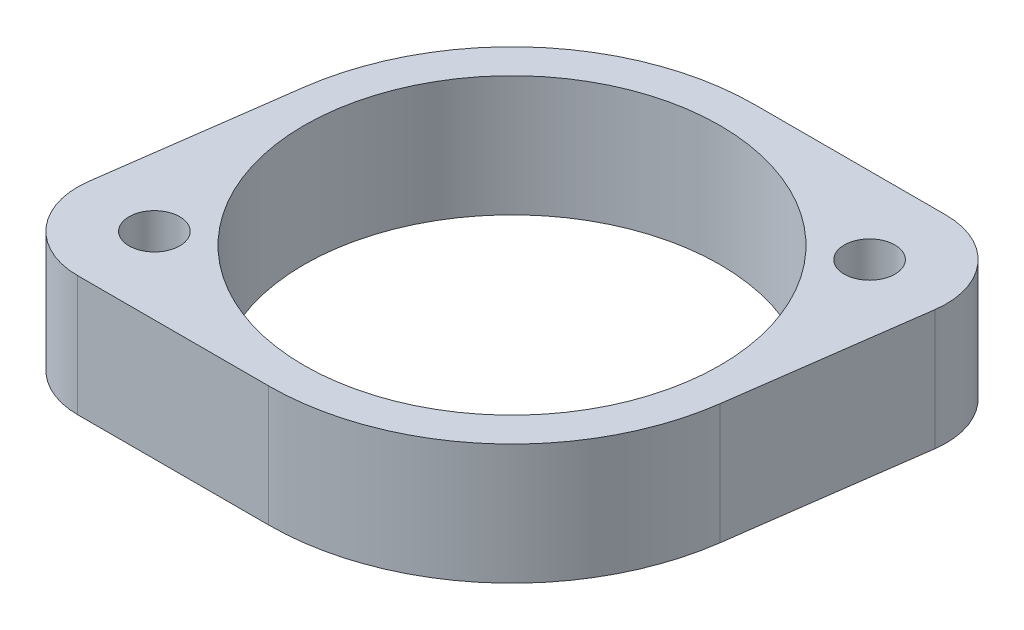
from build123d import *

# Parameters (mm, degrees)
SKETCH1_R           = 2.778125
SKETCH1_R_2         = 22.787762628
BOSS_EXTRUDE1_DEPTH = 13.208


with BuildPart() as part:
    # Sketch1 → Boss-Extrude1 (new body)
    with BuildSketch(Plane(origin=(0, 0, 0), x_dir=(1, 0, 0), z_dir=(0, 1, 0))):
        with BuildLine():
            Line((-29.275762083, -17.109232653), (-26.421007751, 3.635828571))
            ThreePointArc((-26.421007751, 3.635828571), (-17.526, 20.10294068), (0, 26.67))
            Line((0, 26.67), (20.940563209, 26.67))
            ThreePointArc((20.940563209, 26.67), (27.282562352, 23.785285714), (29.275762083, 17.109232653))
            Line((29.275762083, 17.109232653), (26.421007751, -3.635828571))
            ThreePointArc((26.421007751, -3.635828571), (17.526, -20.10294068), (0, -26.67))
            Line((0, -26.67), (-20.940563209, -26.67))
            ThreePointArc((-20.940563209, -26.67), (-27.282562352, -23.785285714), (-29.275762083, -17.109232653))
        make_face()
        with Locations(Location((20.940563209, 18.25625, 0), (0, 0, 90))):
            Circle(SKETCH1_R, mode=Mode.SUBTRACT)
        with Locations(Location((-20.940563209, -18.25625, 0), (0, 0, 90))):
            Circle(SKETCH1_R, mode=Mode.SUBTRACT)
        with Locations(Location((0, 0, 0), (0, 0, 90))):
            Circle(SKETCH1_R_2, mode=Mode.SUBTRACT)
    extrude(amount=BOSS_EXTRUDE1_DEPTH)


solid = part.part
